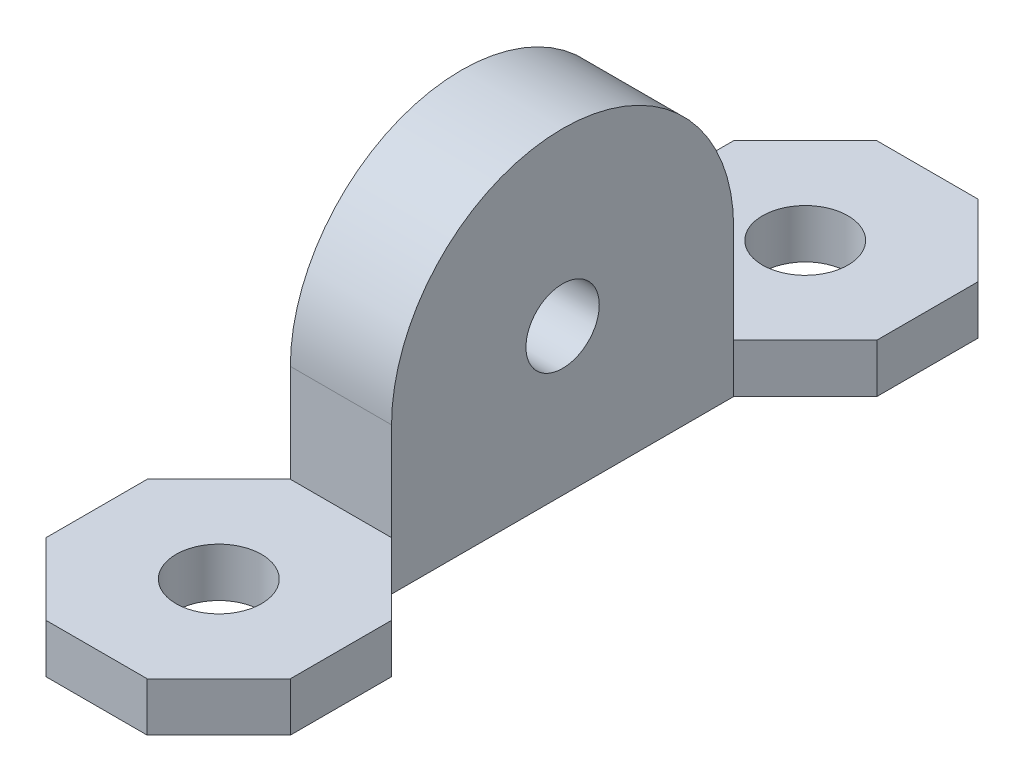
from build123d import *

# Parameters (mm, degrees)
BOSS_EXTRU_1_DEPTH             = 2
BOSS_EXTRU_2_REACH             = 23.477
BOSS_EXTRU_2_DIRECTION_2_REACH = 23.477
ESQUISSE6_R                    = 1.5
ENL_V_MAT_EXTRU_3_DEPTH        = 26.464516662
ESQUISSE7_R                    = 1.75
ENL_V_MAT_EXTRU_4_DEPTH        = 25.047357729


with BuildPart() as part:
    # Esquisse1 → Boss.-Extru.1 (new body)
    with BuildSketch(Plane(origin=(0, 0, 0), x_dir=(1, 0, 0), z_dir=(0, 1, 0))):
        Polygon((1.795292522, 13.277027027), (-2.346843102, 13.277027027), (-5.27577529, 10.348094839), (-5.27577529, 6.205959215), (-2.346843102, 3.277027027), (-2.346843102, -10.722972973), (-5.27577529, -13.651905161), (-5.27577529, -17.794040785), (-2.346843102, -20.722972973), (1.795292522, -20.722972973), (4.72422471, -17.794040785), (4.72422471, -13.651905161), (1.795292522, -10.722972973), (1.795292522, 3.277027027), (4.72422471, 6.205959215), (4.72422471, 10.348094839), align=None)
    extrude(amount=BOSS_EXTRU_1_DEPTH)

    # Boss.-Extru.2: up to this face of the body (flat: up to its plane)
    boss_extru_2_end = Plane(part.part.faces().sort_by_distance((1.795292522, 1, 3.722972973))[0])
    # Esquisse3 → Boss.-Extru.2 (add, up to the picked face)
    with BuildSketch(Plane(origin=(0, 0, 0), x_dir=(0, 0, -1), z_dir=(1, 0, 0)), mode=Mode.PRIVATE) as boss_extru_2_sk1:
        with BuildLine():
            Line((-10.722972973, 0), (-10.722972973, 6))
            ThreePointArc((-10.722972973, 6), (-3.722972973, 13), (3.277027027, 6))
            Line((3.277027027, 6), (3.277027027, 0))
            Line((3.277027027, 0), (-10.722972973, 0))
        make_face()
    boss_extru_2_tool1 = split(extrude(boss_extru_2_sk1.sketch, amount=BOSS_EXTRU_2_REACH, mode=Mode.PRIVATE), bisect_by=boss_extru_2_end, keep=Keep.BOTH, mode=Mode.PRIVATE)
    add(boss_extru_2_tool1.solids().sort_by(Axis((0, 5.855045, 3.722973), (1, 0, 0)))[0])

    # Boss.-Extru.2 direction 2: up to this face of the body (flat: up to its plane)
    boss_extru_2_direction_2_end = Plane(part.part.faces().sort_by_distance((-2.346843102, 1, 3.722972973))[0])
    # Esquisse3 → Boss.-Extru.2 direction 2 (add, up to the picked face)
    with BuildSketch(Plane(origin=(0, 0, 0), x_dir=(0, 0, -1), z_dir=(1, 0, 0)), mode=Mode.PRIVATE) as boss_extru_2_direction_2_sk1:
        with BuildLine():
            Line((-10.722972973, 0), (-10.722972973, 6))
            ThreePointArc((-10.722972973, 6), (-3.722972973, 13), (3.277027027, 6))
            Line((3.277027027, 6), (3.277027027, 0))
            Line((3.277027027, 0), (-10.722972973, 0))
        make_face()
    boss_extru_2_direction_2_tool1 = split(extrude(boss_extru_2_direction_2_sk1.sketch, amount=-BOSS_EXTRU_2_DIRECTION_2_REACH, mode=Mode.PRIVATE), bisect_by=boss_extru_2_direction_2_end, keep=Keep.BOTH, mode=Mode.PRIVATE)
    add(boss_extru_2_direction_2_tool1.solids().sort_by(Axis((0, 5.855045, 3.722973), (-1, 0, 0)))[0])

    # Esquisse6 → Enlèv. mat.-Extru.3 (cut, through all)
    with BuildSketch(Plane(origin=(1.795292522, 0, 0), x_dir=(0, 0, -1), z_dir=(1, 0, 0))):
        with Locations((-3.722972973, 6)):
            Circle(ESQUISSE6_R)
    extrude(amount=-ENL_V_MAT_EXTRU_3_DEPTH, mode=Mode.SUBTRACT)

    # Esquisse7 → Enlèv. mat.-Extru.4 (cut, through all)
    with BuildSketch(Plane(origin=(0, 2, 0), x_dir=(1, 0, 0), z_dir=(0, 1, 0))):
        with Locations(Location((-0.27577529, -15.722972973, 0), (0, 0, 270))):
            Circle(ESQUISSE7_R)
        with Locations(Location((-0.27577529, 8.277027027, 0), (0, 0, 270))):
            Circle(ESQUISSE7_R)
    extrude(amount=-ENL_V_MAT_EXTRU_4_DEPTH, mode=Mode.SUBTRACT)


solid = part.part
